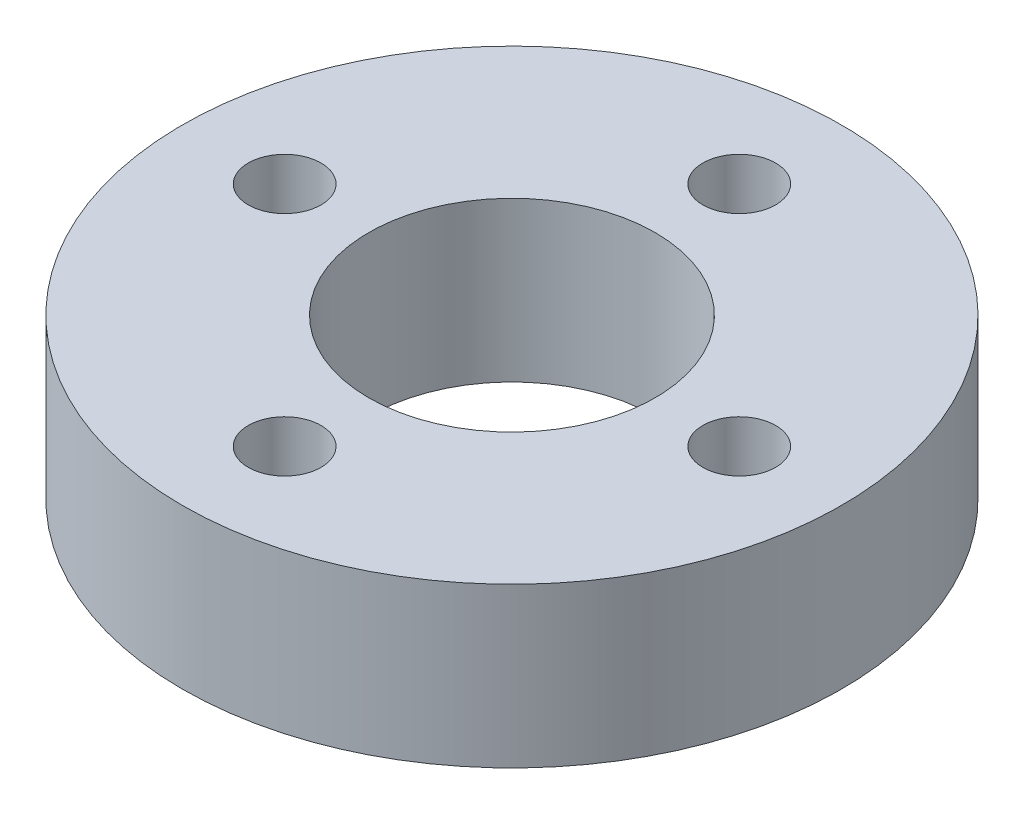
from build123d import *

# Parameters (mm, degrees)
SKETCH_1_R      = 14.5
SKETCH_1_R_2    = 6.3
SKETCH_1_R_3    = 1.6
EXTRUDE_1_DEPTH = 7


with BuildPart() as part:
    # 草图1 → 凸台-拉伸1 (new body)
    with BuildSketch(Plane(origin=(0, 0, 0), x_dir=(1, 0, 0), z_dir=(0, 1, 0))):
        with Locations(Location((0, 0, 0), (0, 0, 270))):
            Circle(SKETCH_1_R)
        with Locations(Location((0, 0, 0), (0, 0, 270))):
            Circle(SKETCH_1_R_2, mode=Mode.SUBTRACT)
        with Locations(Location((-10, 0, 0), (0, 0, 270))):
            Circle(SKETCH_1_R_3, mode=Mode.SUBTRACT)
        with Locations(Location((0, 10, 0), (0, 0, 270))):
            Circle(SKETCH_1_R_3, mode=Mode.SUBTRACT)
        with Locations(Location((10, 0, 0), (0, 0, 270))):
            Circle(SKETCH_1_R_3, mode=Mode.SUBTRACT)
        with Locations(Location((0, -10, 0), (0, 0, 270))):
            Circle(SKETCH_1_R_3, mode=Mode.SUBTRACT)
    extrude(amount=EXTRUDE_1_DEPTH)


solid = part.part
